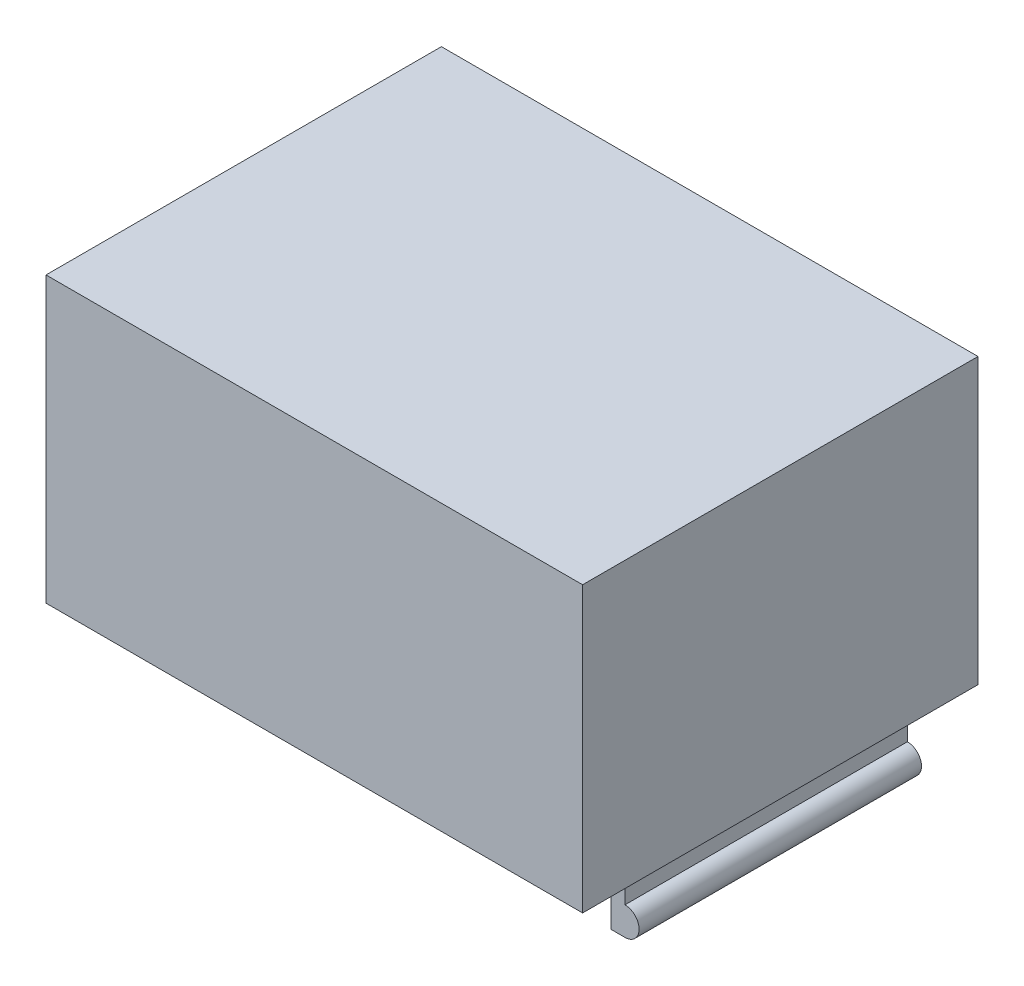
from build123d import *

# Parameters (mm, degrees)
SKETCH1_W           = 48.26
SKETCH1_H           = 25.5651
BOSS_EXTRUDE1_DEPTH = 17.78
SHELL1_T            = -2.54
SKETCH2_R           = 3.175
BOSS_EXTRUDE2_DEPTH = 25.4
BOSS_EXTRUDE3_DEPTH = 12.7


with BuildPart() as part:
    # Sketch1 → Boss-Extrude1 (new, symmetric)
    with BuildSketch(Plane.XY):
        with Locations((24.13, -12.78255)):
            Rectangle(SKETCH1_W, SKETCH1_H)
    extrude(amount=BOSS_EXTRUDE1_DEPTH, both=True)

    # Shell1
    shell1_openings = [part.faces().sort_by_distance(p)[0] for p in [
        (24.13, -25.5651, 0),
    ]]
    offset(amount=SHELL1_T, openings=shell1_openings, kind=Kind.INTERSECTION)

    # Sketch2 → Boss-Extrude2 (add)
    with BuildSketch(Plane.XZ.offset(2.54)):
        with Locations(Location((27.94, 0, 0), (0, 0, 90))):
            Circle(SKETCH2_R)
    extrude(amount=BOSS_EXTRUDE2_DEPTH)

    # Sketch3 → Boss-Extrude3 (add, symmetric)
    with BuildSketch(Plane.XY):
        with BuildLine():
            Line((1.27, -25.5651), (2.54, -25.5651))
            Line((2.54, -25.5651), (2.54, -30.6451))
            Line((2.54, -30.6451), (1.27, -30.6451))
            ThreePointArc((1.27, -30.6451), (0, -29.3751), (1.27, -28.1051))
            Line((1.27, -28.1051), (1.27, -25.5651))
        make_face()
        with BuildLine():
            Line((45.72, -25.5651), (45.72, -30.6451))
            Line((45.72, -30.6451), (46.99, -30.6451))
            ThreePointArc((46.99, -30.6451), (48.26, -29.3751), (46.99, -28.1051))
            Line((46.99, -28.1051), (46.99, -25.5651))
            Line((46.99, -25.5651), (45.72, -25.5651))
        make_face()
    extrude(amount=BOSS_EXTRUDE3_DEPTH, both=True)


solid = part.part
